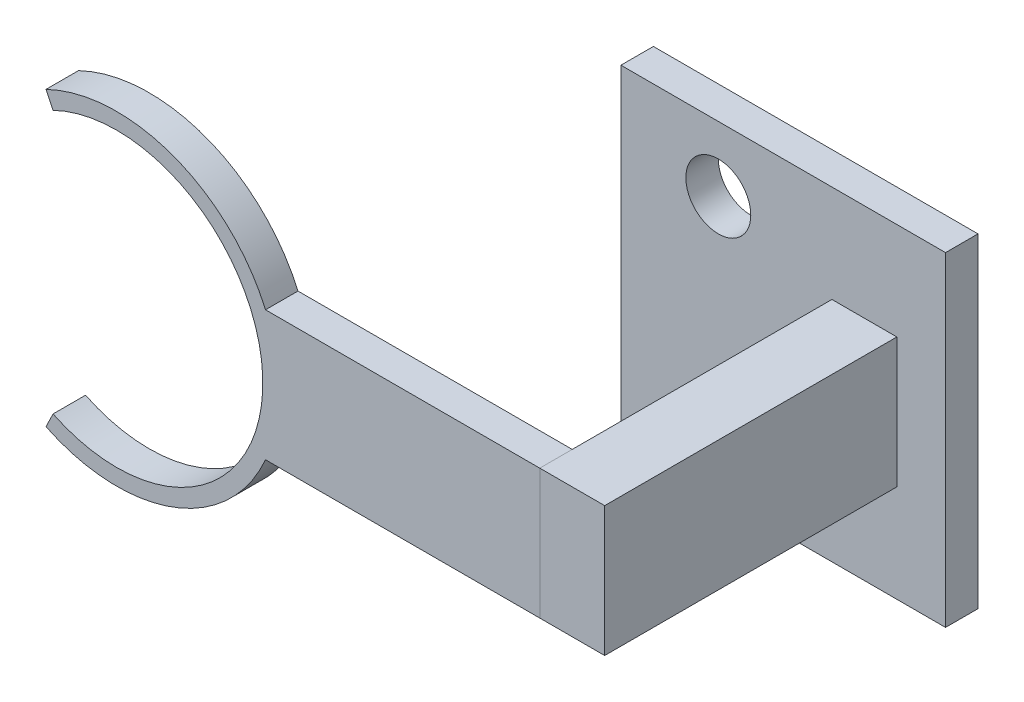
from build123d import *

# Parameters (mm, degrees)
SKETCH1_W           = 20
SKETCH1_H           = 20
SKETCH1_R           = 2
BOSS_EXTRUDE1_DEPTH = 2
SKETCH2_W           = 4
SKETCH2_H           = 8
BOSS_EXTRUDE2_DEPTH = 18
BOSS_EXTRUDE3_DEPTH = 2


with BuildPart() as part:
    # Sketch1 → Boss-Extrude1 (new body)
    with BuildSketch(Plane.XY):
        Rectangle(SKETCH1_W, SKETCH1_H)
        with Locations((-4, 6)):
            Circle(SKETCH1_R, mode=Mode.SUBTRACT)
        with Locations(Location((-4, -6, 0), (0, 0, 180))):
            Circle(SKETCH1_R, mode=Mode.SUBTRACT)
    extrude(amount=BOSS_EXTRUDE1_DEPTH)

    # Sketch2 → Boss-Extrude2 (add)
    with BuildSketch(Plane.XY.offset(2)):
        with Locations((5, 0)):
            Rectangle(SKETCH2_W, SKETCH2_H)
    extrude(amount=BOSS_EXTRUDE2_DEPTH)


with BuildPart() as body_2:
    # Sketch3 → Boss-Extrude3 (new body)
    with BuildSketch(Plane.XY.offset(20)):
        with BuildLine():
            ThreePointArc((-26.985266797, 8.1), (-14.062257748, 0), (-26.985266797, -8.1))
            Line((-26.985266797, -8.1), (-27.421156692, -9))
            ThreePointArc((-27.421156692, -9), (-19.594547316, -9.379498087), (-13.897106358, -4))
            Line((-13.897106358, -4), (3, -4))
            Line((3, -4), (3, 0))
            Line((3, 0), (3, 4))
            Line((3, 4), (-13.897106358, 4))
            ThreePointArc((-13.897106358, 4), (-19.594547316, 9.379498087), (-27.421156692, 9))
            Line((-27.421156692, 9), (-26.985266797, 8.1))
        make_face()
    extrude(amount=-BOSS_EXTRUDE3_DEPTH)


solid = Compound([part.part, body_2.part])
